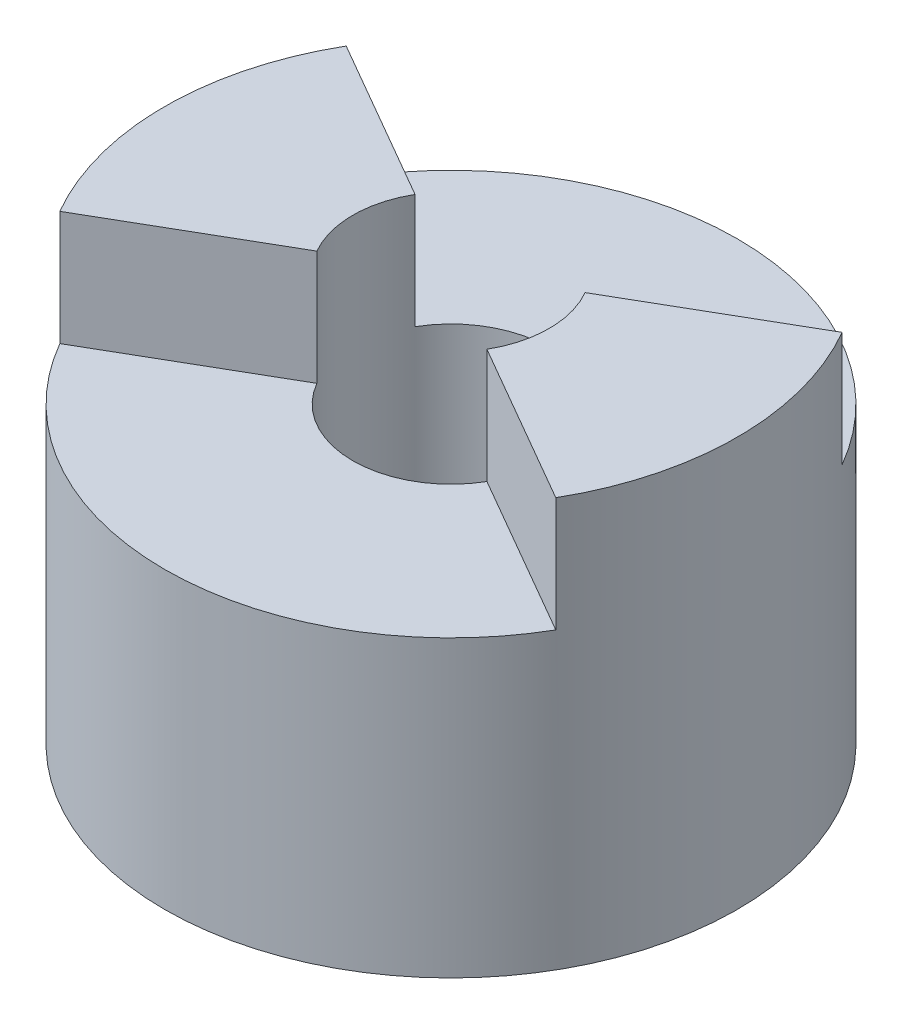
from build123d import *

# Parameters (mm, degrees)
SKETCH1_R           = 35
SKETCH1_R_2         = 12
BOSS_EXTRUDE1_DEPTH = 50
CUT_EXTRUDE1_START  = -14
CUT_EXTRUDE1_DEPTH  = 14


with BuildPart() as part:
    # Sketch1 → Boss-Extrude1 (new body)
    with BuildSketch(Plane(origin=(0, 0, 0), x_dir=(1, 0, 0), z_dir=(0, 1, 0))):
        with Locations(Location((0, 0, 0), (0, 0, 270))):
            Circle(SKETCH1_R)
        with Locations(Location((0, 0, 0), (0, 0, 270))):
            Circle(SKETCH1_R_2, mode=Mode.SUBTRACT)
    extrude(amount=BOSS_EXTRUDE1_DEPTH)

    # Sketch2 → Cut-Extrude1 (cut)
    with BuildSketch(Plane(origin=(0, 50, 0), x_dir=(1, 0, 0), z_dir=(0, 1, 0)).offset(CUT_EXTRUDE1_START)):
        with BuildLine():
            Line((10.392304845, -6), (30.310889132, -17.5))
            ThreePointArc((30.310889132, -17.5), (0, -35), (-30.310889132, -17.5))
            Line((-30.310889132, -17.5), (-10.392304845, -6))
            ThreePointArc((-10.392304845, -6), (0, -12), (10.392304845, -6))
        make_face()
    cut_extrude1 = extrude(amount=CUT_EXTRUDE1_DEPTH, mode=Mode.SUBTRACT)

    # Mirror1: Cut-Extrude1 across plane
    add(cut_extrude1.mirror(Plane.XY), mode=Mode.SUBTRACT)


solid = part.part
